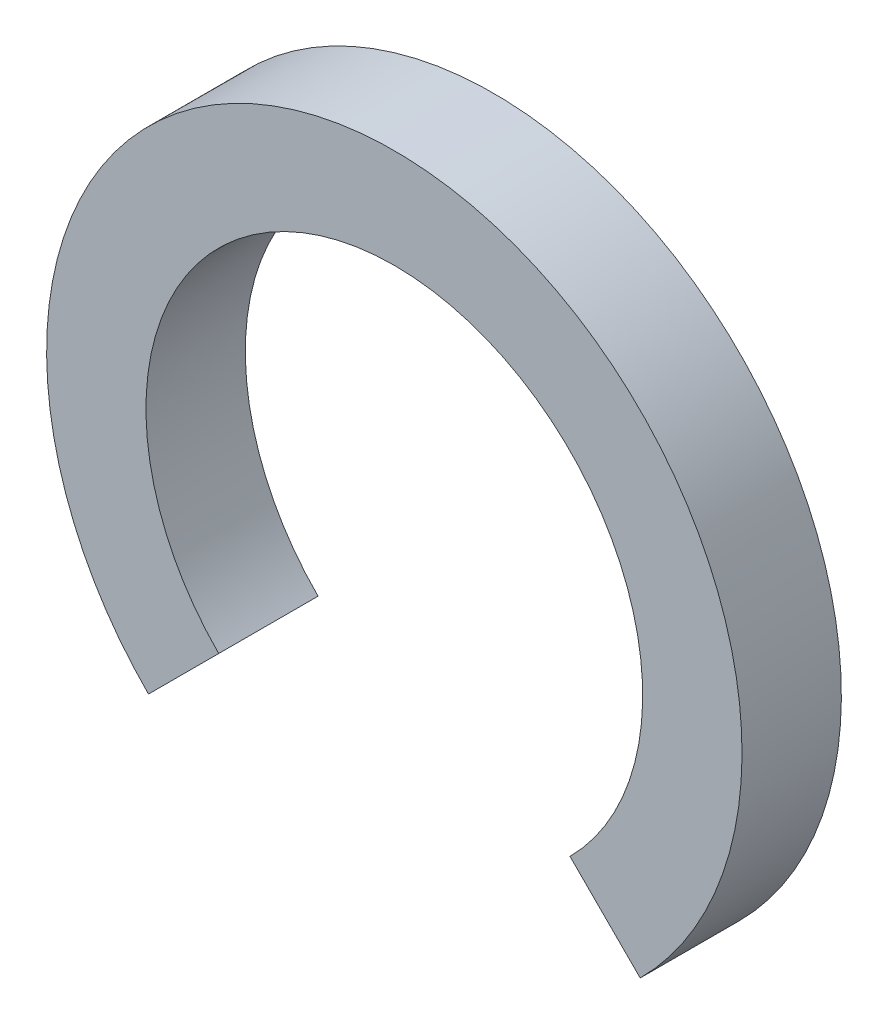
from build123d import *

# Parameters (mm, degrees)
BOSS_EXTRU_1_DEPTH = 1


with BuildPart() as part:
    # Esquisse1 → Boss.-Extru.1 (new body)
    with BuildSketch(Plane.XY):
        with BuildLine():
            Line((1.767766953, -1.767766953), (2.474873734, -2.474873734))
            ThreePointArc((2.474873734, -2.474873734), (0, 3.5), (-2.474873734, -2.474873734))
            Line((-2.474873734, -2.474873734), (-1.767766953, -1.767766953))
            ThreePointArc((-1.767766953, -1.767766953), (0, 2.5), (1.767766953, -1.767766953))
        make_face()
    extrude(amount=BOSS_EXTRU_1_DEPTH)


solid = part.part
